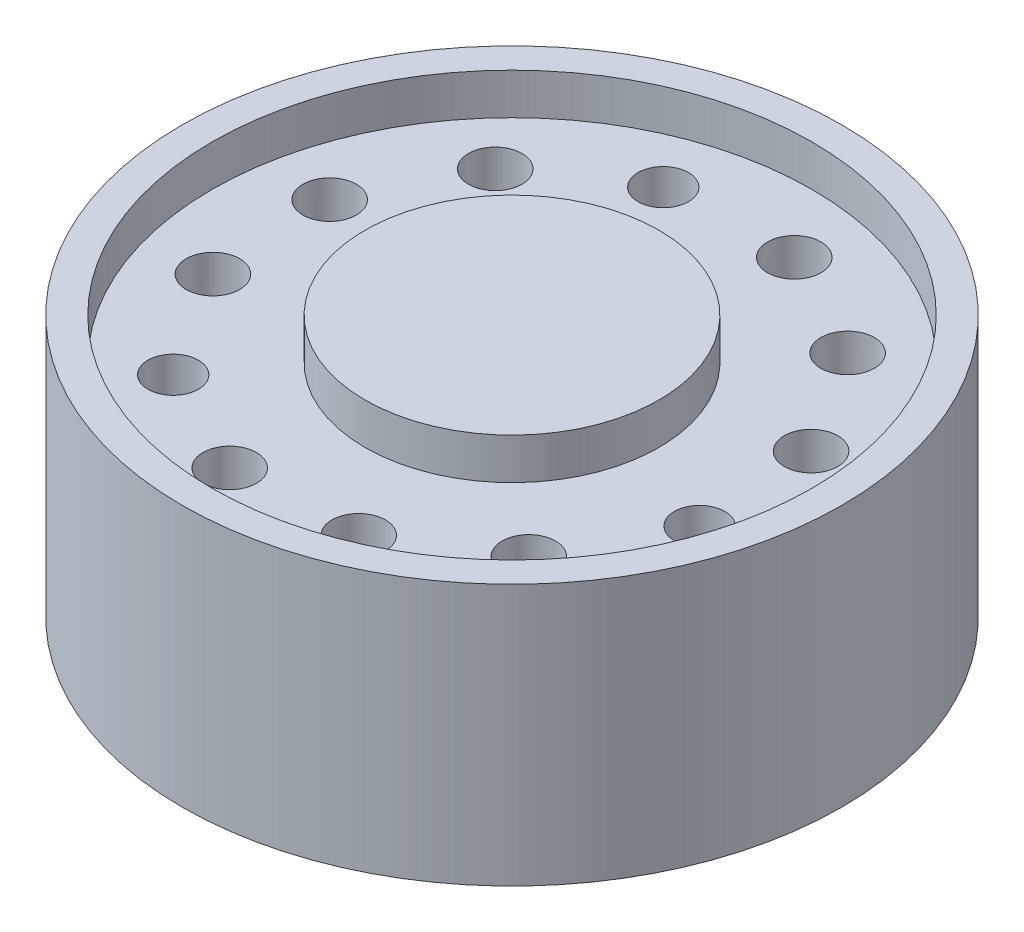
from build123d import *

# Parameters (mm, degrees)
CROQUIS1_R                                           = 55.5
SALIENTE_EXTRUIR1_DEPTH                              = 44
CROQUIS2_R                                           = 50.5
CROQUIS2_R_2                                         = 24.75
CORTAR_EXTRUIR2_DEPTH                                = 6.93
REFRENTADO_PARA_TORNILLO_CON_CABEZA_TRON_D           = 9
REFRENTADO_PARA_TORNILLO_CON_CABEZA_TRON_CBORE_D     = 18
REFRENTADO_PARA_TORNILLO_CON_CABEZA_TRON_CBORE_DEPTH = 30
TALADRO_ROSCADO_M10X1_51_D                           = 8.5


with BuildPart() as part:
    # Croquis1 → Saliente-Extruir1 (new body)
    with BuildSketch(Plane(origin=(0, 0, 0), x_dir=(1, 0, 0), z_dir=(0, 1, 0))):
        with Locations(Location((0, 0, 0), (0, 0, 270))):
            Circle(CROQUIS1_R)
    extrude(amount=SALIENTE_EXTRUIR1_DEPTH)

    # Croquis2 → Cortar-Extruir2 (cut)
    with BuildSketch(Plane(origin=(0, 44, 0), x_dir=(1, 0, 0), z_dir=(0, 1, 0))):
        with Locations(Location((0, 0, 0), (0, 0, 270))):
            Circle(CROQUIS2_R)
        with Locations(Location((0, 0, 0), (0, 0, 270))):
            Circle(CROQUIS2_R_2, mode=Mode.SUBTRACT)
    extrude(amount=-CORTAR_EXTRUIR2_DEPTH, mode=Mode.SUBTRACT)

    # Refrentado para tornillo con cabeza troncocónica de M81 (through all)
    with Locations(Plane(origin=(0, 0, 0), x_dir=(-1, 0, 0), z_dir=(0, -1, 0))):
        with Locations((8.40999002, -39.10590835), (-12.269689172, -38.071705079), (-29.661715059, -26.836219178), (-38.071705079, 12.269689172), (-26.836219178, 29.661715059), (-8.40999002, 39.10590835), (29.661715059, 26.836219178), (39.10590835, 8.40999002), (38.071705079, -12.269689172)):
            CounterBoreHole(REFRENTADO_PARA_TORNILLO_CON_CABEZA_TRON_D / 2, REFRENTADO_PARA_TORNILLO_CON_CABEZA_TRON_CBORE_D / 2, REFRENTADO_PARA_TORNILLO_CON_CABEZA_TRON_CBORE_DEPTH)

    # Taladro roscado M10x1.51 (through all)
    with Locations(Plane(origin=(0, 0, 0), x_dir=(-1, 0, 0), z_dir=(0, -1, 0))):
        with Locations((26.755142579, -30.284161629), (-39.604424593, -8.02855234), (12.849282014, 38.31271397)):
            Hole(TALADRO_ROSCADO_M10X1_51_D / 2)


solid = part.part
